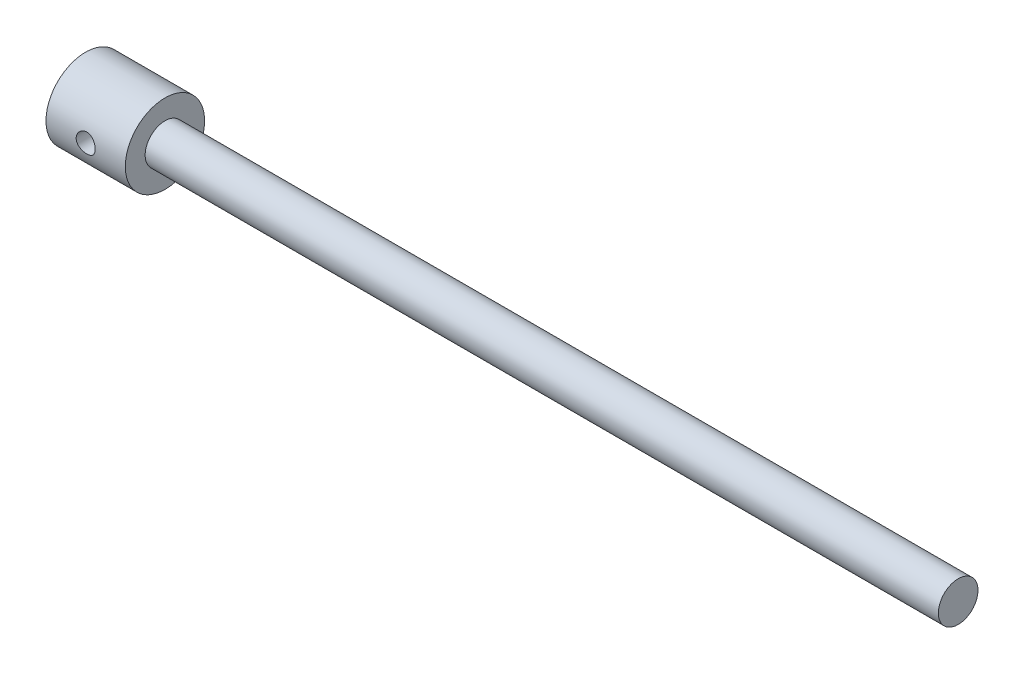
from build123d import *

# Parameters (mm, degrees)
SKETCH2_R           = 12.5
BOSS_EXTRUDE1_DEPTH = 275
SKETCH3_R           = 25
BOSS_EXTRUDE2_DEPTH = 50
SKETCH4_R           = 6
CUT_EXTRUDE1_DEPTH  = 282.558164506


with BuildPart() as part:
    # Sketch2 → Boss-Extrude1 (new, symmetric)
    with BuildSketch(Plane(origin=(0, 0, 0), x_dir=(0, 0, -1), z_dir=(1, 0, 0))):
        Circle(SKETCH2_R)
    extrude(amount=BOSS_EXTRUDE1_DEPTH, both=True)

    # Sketch3 → Boss-Extrude2 (add)
    with BuildSketch(Plane.ZY.offset(275)):
        Circle(SKETCH3_R)
    extrude(amount=-BOSS_EXTRUDE2_DEPTH)

    # Sketch4 → Cut-Extrude1 (cut, through all)
    with BuildSketch(Plane.XY.offset(30)):
        with Locations((-250, 0)):
            Circle(SKETCH4_R)
    extrude(amount=-CUT_EXTRUDE1_DEPTH, mode=Mode.SUBTRACT)


solid = part.part
